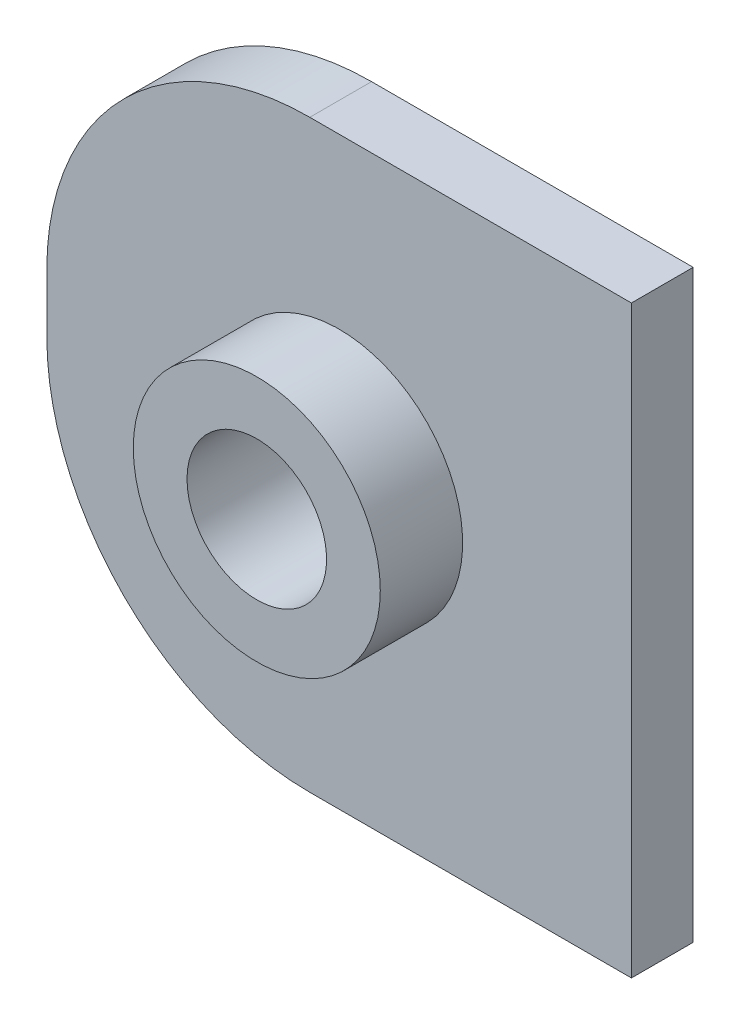
from build123d import *

# Parameters (mm, degrees)
SKETCH1_W           = 18.034
SKETCH1_H           = 18.034
SKETCH1_R           = 2.15265
BOSS_EXTRUDE1_DEPTH = 1.905
SKETCH2_R           = 3.81
SKETCH2_R_2         = 2.15265
BOSS_EXTRUDE2_DEPTH = 2.54
CUT_EXTRUDE1_DEPTH  = 14.504466039


with BuildPart() as part:
    # Sketch1 → Boss-Extrude1 (new body)
    with BuildSketch(Plane.XY):
        Rectangle(SKETCH1_W, SKETCH1_H)
        with Locations(Location((0, 0, 0), (0, 0, 180))):
            Circle(SKETCH1_R, mode=Mode.SUBTRACT)
    extrude(amount=BOSS_EXTRUDE1_DEPTH)

    # Sketch2 → Boss-Extrude2 (add)
    with BuildSketch(Plane.XY.offset(1.905)):
        with Locations(Location((0, 0, 0), (0, 0, 180))):
            Circle(SKETCH2_R)
        with Locations(Location((0, 0, 0), (0, 0, 180))):
            Circle(SKETCH2_R_2, mode=Mode.SUBTRACT)
    extrude(amount=BOSS_EXTRUDE2_DEPTH)

    # Sketch3 → Cut-Extrude1 (cut, through all)
    with BuildSketch(Plane(origin=(0, 0, 0), x_dir=(-1, 0, 0), z_dir=(0, 0, -1))):
        with BuildLine():
            Line((9.017, 0.904485111), (9.017, 9.017))
            Line((9.017, 9.017), (0.904485111, 9.017))
            ThreePointArc((0.904485111, 9.017), (6.640899402, 6.640899402), (9.017, 0.904485111))
        make_face()
        with BuildLine():
            Line((9.017, -9.017), (0.904485111, -9.017))
            ThreePointArc((0.904485111, -9.017), (6.640899402, -6.640899402), (9.017, -0.904485111))
            Line((9.017, -0.904485111), (9.017, -9.017))
        make_face()
    extrude(amount=-CUT_EXTRUDE1_DEPTH, mode=Mode.SUBTRACT)


solid = part.part
